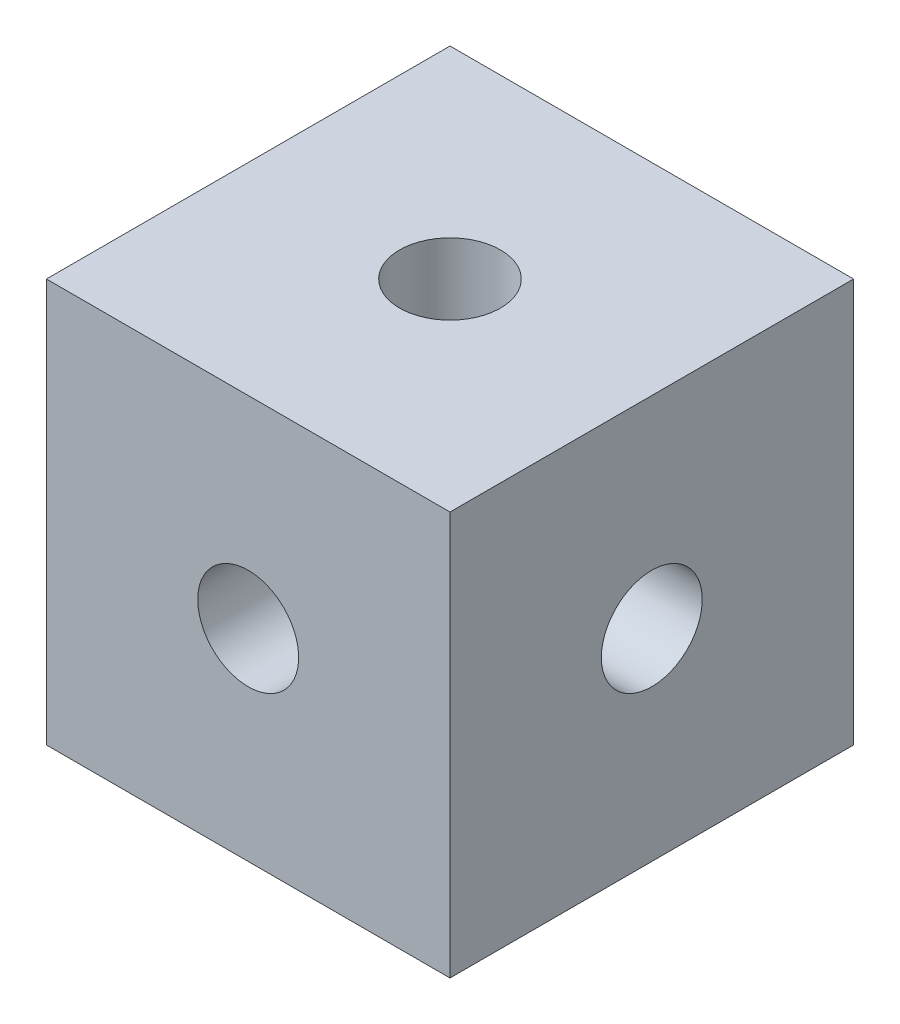
from build123d import *

# Parameters (mm, degrees)
SKETCH_1_W                   = 10
SKETCH_1_H                   = 10
EXTRUDE_1_DEPTH              = 10
HOLE_WIZARD_M3_1_D           = 2.5
HOLE_WIZARD_M3_1_CSINK_D     = 3.05
HOLE_WIZARD_M3_1_CSINK_ANGLE = 90
HOLE_WIZARD_M3_2_D           = 2.5
HOLE_WIZARD_M3_2_CSINK_D     = 3.05
HOLE_WIZARD_M3_2_CSINK_ANGLE = 90
HOLE_WIZARD_M3_3_D           = 2.5
HOLE_WIZARD_M3_3_CSINK_D     = 3.05
HOLE_WIZARD_M3_3_CSINK_ANGLE = 90


with BuildPart() as part:
    # 草图1 → 凸台-拉伸1 (new body)
    with BuildSketch(Plane(origin=(0, 0, 0), x_dir=(1, 0, 0), z_dir=(0, 1, 0))):
        Rectangle(SKETCH_1_W, SKETCH_1_H)
    extrude(amount=EXTRUDE_1_DEPTH)

    # M3 螺纹孔1 (through all)
    with Locations(Plane(origin=(0, 0, 0), x_dir=(-1, 0, 0), z_dir=(0, -1, 0))):
        with Locations((0, 0)):
            CounterSinkHole(HOLE_WIZARD_M3_1_D / 2, HOLE_WIZARD_M3_1_CSINK_D / 2, counter_sink_angle=HOLE_WIZARD_M3_1_CSINK_ANGLE)

    # M3 螺纹孔2 (through all)
    with Locations(Plane(origin=(0, 0, -5), x_dir=(-1, 0, 0), z_dir=(0, 0, -1))):
        with Locations((0, 5)):
            CounterSinkHole(HOLE_WIZARD_M3_2_D / 2, HOLE_WIZARD_M3_2_CSINK_D / 2, counter_sink_angle=HOLE_WIZARD_M3_2_CSINK_ANGLE)

    # M3 螺纹孔3 (through all)
    with Locations(Plane.ZY.offset(5)):
        with Locations((0, 5)):
            CounterSinkHole(HOLE_WIZARD_M3_3_D / 2, HOLE_WIZARD_M3_3_CSINK_D / 2, counter_sink_angle=HOLE_WIZARD_M3_3_CSINK_ANGLE)


solid = part.part
